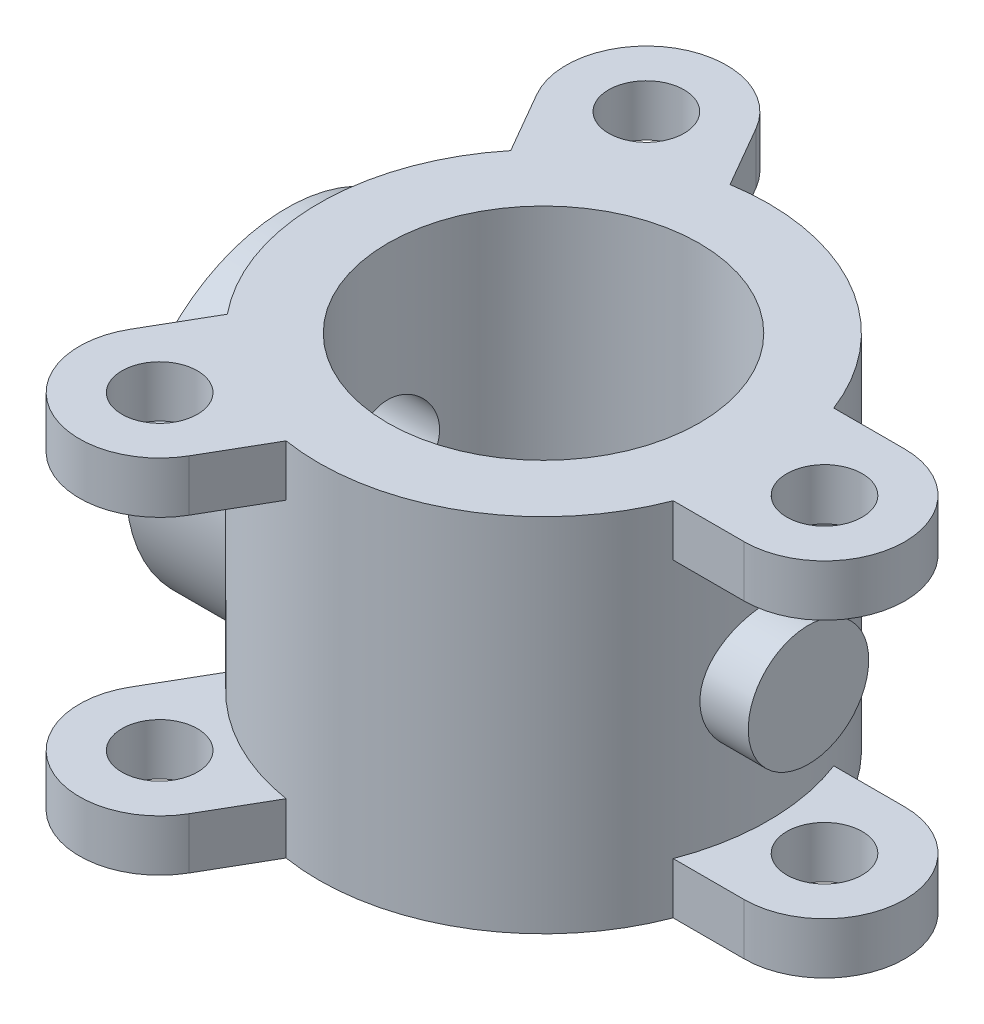
from build123d import *

# Parameters (mm, degrees)
SKETCH1_R               = 140
SKETCH1_R_2             = 97
BOSS_EXTRUDE1_DEPTH     = 112.5
SKETCH2_R               = 23.5
BOSS_EXTRUDE2_DEPTH     = 32
CIRPATTERN1_COUNT       = 3
MIRROR1_COPY_1_SKETCH_R = 23.5
MIRROR1_COPY_1_DEPTH    = 32
MIRROR1_COPY_2_SKETCH_R = 23.5
MIRROR1_COPY_2_DEPTH    = 32
BOSS_EXTRUDE3_REACH     = 450.894
SKETCH7_R               = 100
SKETCH8_R               = 50
CUT_EXTRUDE1_DEPTH      = 25
BOSS_EXTRUDE4_REACH     = 400.629
SKETCH10_R              = 37.5
SKETCH9_R               = 28.1
CUT_EXTRUDE2_DEPTH      = 285
SKETCH11_R              = 10.15
CUT_EXTRUDE3_DEPTH      = 15
CIRPATTERN2_COUNT       = 3


with BuildPart() as part:
    # Sketch1 → Boss-Extrude1 (new, symmetric)
    with BuildSketch(Plane(origin=(0, 0, 0), x_dir=(1, 0, 0), z_dir=(0, 1, 0))):
        Circle(SKETCH1_R)
        Circle(SKETCH1_R_2, mode=Mode.SUBTRACT)
    extrude(amount=BOSS_EXTRUDE1_DEPTH, both=True)

    # Sketch2 → Boss-Extrude2 (add)
    with BuildSketch(Plane(origin=(0, 112.5, 0), x_dir=(1, 0, 0), z_dir=(0, 1, 0))):
        with BuildLine():
            Line((175, 50), (130.766968306, 50))
            ThreePointArc((130.766968306, 50), (140, 0), (130.766968306, -50))
            Line((130.766968306, -50), (175, -50))
            ThreePointArc((175, -50), (225, 0), (175, 50))
        make_face()
        with Locations((175, 0)):
            Circle(SKETCH2_R, mode=Mode.SUBTRACT)
    boss_extrude2 = extrude(amount=-BOSS_EXTRUDE2_DEPTH)

    # CirPattern1: Boss-Extrude2 ×3 about axis
    cirpattern1_axis = Axis((0, 0, 0), (0, 1, 0))
    for i in range(1, CIRPATTERN1_COUNT):
        add(boss_extrude2.rotate(cirpattern1_axis, i * 360 / CIRPATTERN1_COUNT))

    # Mirror1: Boss-Extrude2 across plane
    add(boss_extrude2.mirror(Plane.ZX))

    # Mirror1 copy 1 sketch → Mirror1 copy 1 (add)
    with BuildSketch(Plane(origin=(0, -112.5, 0), x_dir=(-0.4999999999999998, 0, -0.8660254037844387), z_dir=(0, -1, 0))):
        with BuildLine():
            Line((175, -50), (130.766968306, -50))
            ThreePointArc((130.766968306, -50), (140, 0), (130.766968306, 50))
            Line((130.766968306, 50), (175, 50))
            ThreePointArc((175, 50), (225, 0), (175, -50))
        make_face()
        with Locations((175, 0)):
            Circle(MIRROR1_COPY_1_SKETCH_R, mode=Mode.SUBTRACT)
    extrude(amount=-MIRROR1_COPY_1_DEPTH)

    # Mirror1 copy 2 sketch → Mirror1 copy 2 (add)
    with BuildSketch(Plane(origin=(0, -112.5, 0), x_dir=(-0.5000000000000004, 0, 0.8660254037844384), z_dir=(0, -1, 0))):
        with BuildLine():
            Line((175, -50), (130.766968306, -50))
            ThreePointArc((130.766968306, -50), (140, 0), (130.766968306, 50))
            Line((130.766968306, 50), (175, 50))
            ThreePointArc((175, 50), (225, 0), (175, -50))
        make_face()
        with Locations((175, 0)):
            Circle(MIRROR1_COPY_2_SKETCH_R, mode=Mode.SUBTRACT)
    extrude(amount=-MIRROR1_COPY_2_DEPTH)

    # Sketch7 → Boss-Extrude3 (add, up to next)
    with BuildSketch(Plane(origin=(-160, 0, 0), x_dir=(0, 0, -1), z_dir=(1, 0, 0)), mode=Mode.PRIVATE) as boss_extrude3_sk1:
        Circle(SKETCH7_R)
    boss_extrude3_tool1 = extrude(boss_extrude3_sk1.sketch, amount=BOSS_EXTRUDE3_REACH, mode=Mode.PRIVATE) - part.part
    add(boss_extrude3_tool1.solids().sort_by_distance((-160, 0, 0))[0])

    # Sketch8 → Cut-Extrude1 (cut)
    with BuildSketch(Plane.ZY.offset(160)):
        Circle(SKETCH8_R)
    extrude(amount=-CUT_EXTRUDE1_DEPTH, mode=Mode.SUBTRACT)

    # Sketch10 → Boss-Extrude4 (add, up to next)
    with BuildSketch(Plane(origin=(165, 0, 0), x_dir=(0, 0, -1), z_dir=(1, 0, 0)), mode=Mode.PRIVATE) as boss_extrude4_sk1:
        Circle(SKETCH10_R)
    boss_extrude4_tool1 = extrude(boss_extrude4_sk1.sketch, amount=-BOSS_EXTRUDE4_REACH, mode=Mode.PRIVATE) - part.part
    add(boss_extrude4_tool1.solids().sort_by_distance((165, 0, 0))[0])

    # Sketch9 → Cut-Extrude2 (cut)
    with BuildSketch(Plane.ZY.offset(135)):
        Circle(SKETCH9_R)
    extrude(amount=-CUT_EXTRUDE2_DEPTH, mode=Mode.SUBTRACT)

    # Sketch11 → Cut-Extrude3 (cut)
    with BuildSketch(Plane.ZY.offset(160)):
        with Locations((0, 75)):
            Circle(SKETCH11_R)
    cut_extrude3 = extrude(amount=-CUT_EXTRUDE3_DEPTH, mode=Mode.SUBTRACT)

    # CirPattern2: Cut-Extrude3 ×3 about axis
    cirpattern2_axis = Axis((0, 0, 0), (1, 0, 0))
    for i in range(1, CIRPATTERN2_COUNT):
        add(cut_extrude3.rotate(cirpattern2_axis, i * 360 / CIRPATTERN2_COUNT), mode=Mode.SUBTRACT)


solid = part.part
